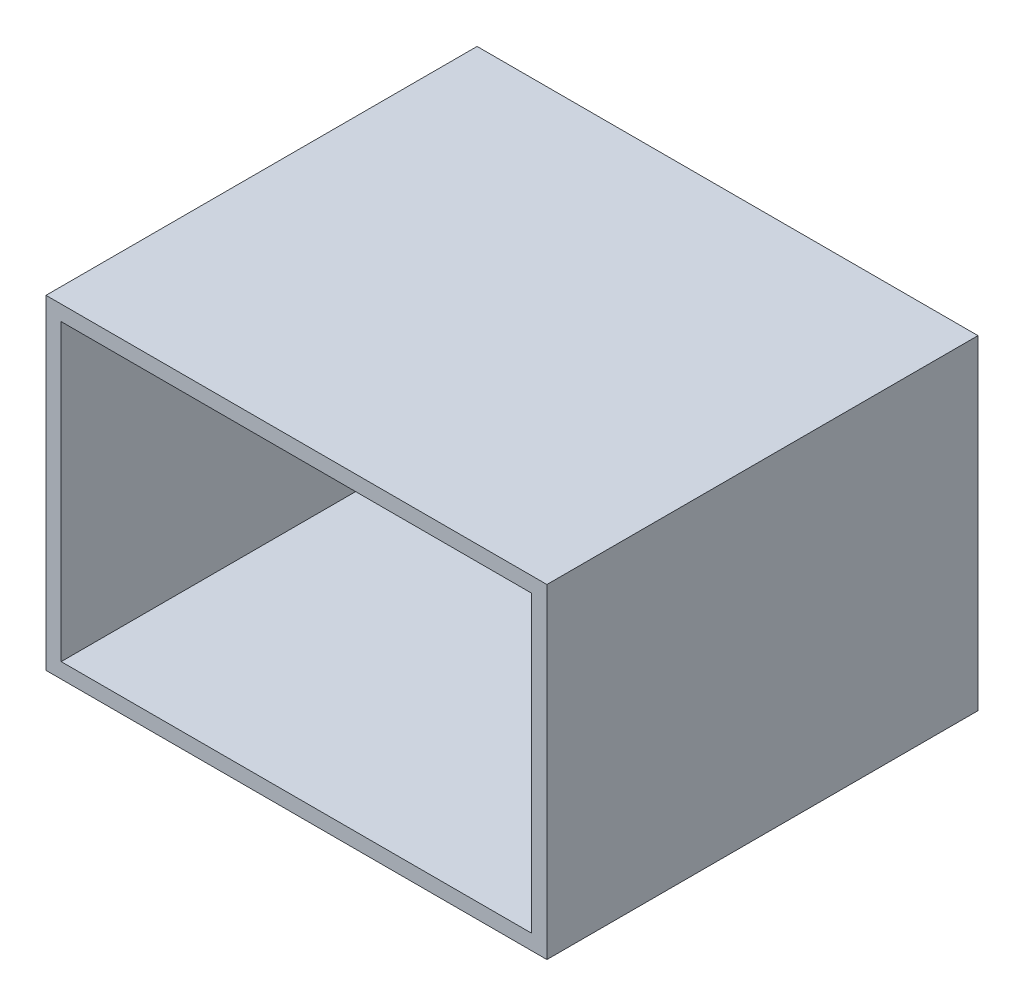
from build123d import *

# Parameters (mm, degrees)
SKETCH2_W           = 165
SKETCH2_H           = 107
SKETCH2_W_2         = 155
SKETCH2_H_2         = 97
BOSS_EXTRUDE1_DEPTH = 142


with BuildPart() as part:
    # Sketch2 → Boss-Extrude1 (new body)
    with BuildSketch(Plane.XY):
        Rectangle(SKETCH2_W, SKETCH2_H)
        Rectangle(SKETCH2_W_2, SKETCH2_H_2, mode=Mode.SUBTRACT)
    extrude(amount=BOSS_EXTRUDE1_DEPTH)


solid = part.part
